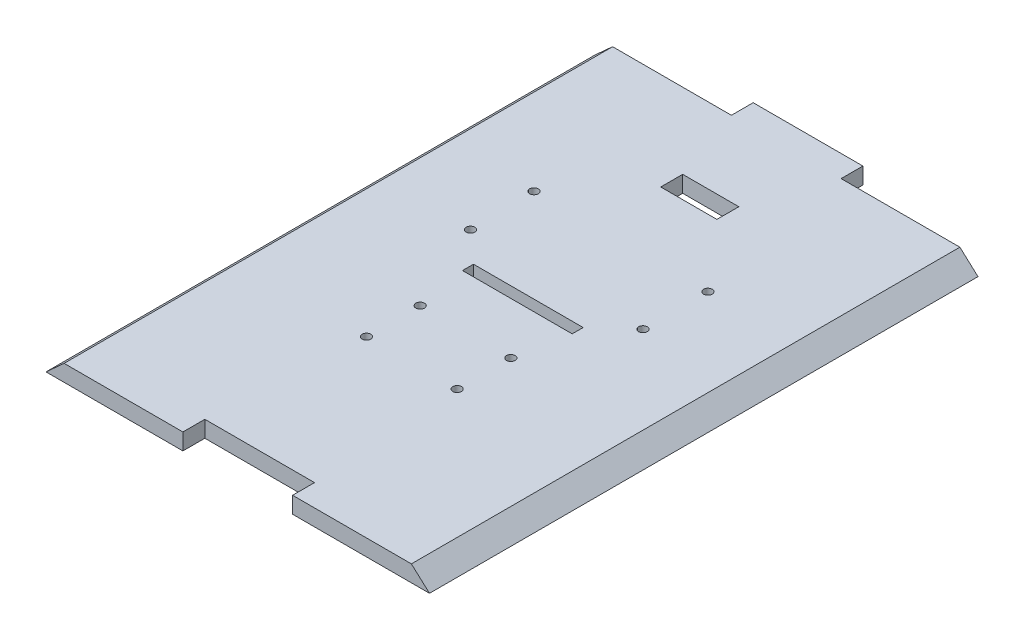
from build123d import *

# Parameters (mm, degrees)
BOSS_EXTRUDE1_DEPTH = 127
SKETCH3_W           = 25.4
SKETCH3_H           = 5.08
CUT_EXTRUDE1_DEPTH  = 135.591199998
SKETCH4_W           = 25.4
SKETCH4_H           = 5.08
BOSS_EXTRUDE3_DEPTH = 3.81
SKETCH5_R           = 1
SKETCH5_R_2         = 0.999998
SKETCH5_W           = 13
SKETCH5_H           = 5.08
SKETCH5_W_2         = 25.4
SKETCH5_H_2         = 2.54
CUT_EXTRUDE2_DEPTH  = 135.591199998


with BuildPart() as part:
    # Sketch1 → Boss-Extrude1 (new body)
    with BuildSketch(Plane.XY):
        Polygon((-40.203883769, 5.937788296), (40.203883769, 5.937788296), (44.399042974, 2.127788296), (-44.399042974, 2.127788296), align=None)
    extrude(amount=BOSS_EXTRUDE1_DEPTH)

    # Sketch3 → Cut-Extrude1 (cut, through all)
    with BuildSketch(Plane.XZ.offset(-2.127788296)):
        with Locations((0, 124.46)):
            Rectangle(SKETCH3_W, SKETCH3_H)
    extrude(amount=-CUT_EXTRUDE1_DEPTH, mode=Mode.SUBTRACT)

    # Sketch4 → Boss-Extrude3 (add)
    with BuildSketch(Plane.XZ.offset(-2.127788296)):
        with Locations((0, -2.504739817)):
            Rectangle(SKETCH4_W, SKETCH4_H)
    extrude(amount=-BOSS_EXTRUDE3_DEPTH)

    # Sketch5 → Cut-Extrude2 (cut, through all)
    with BuildSketch(Plane(origin=(0, 2.127788296, 0), x_dir=(-1, 0, 0), z_dir=(0, -1, 0))):
        with Locations(Location((-19.96, -38.1, 0), (0, 0, 90))):
            Circle(SKETCH5_R)
        with Locations(Location((20.313021022, -38.1, 0), (0, 0, 90))):
            Circle(SKETCH5_R)
        with Locations(Location((19.96, -53.142840099, 0), (0, 0, 90))):
            Circle(SKETCH5_R)
        with Locations(Location((-19.96, -53.142840099, 0), (0, 0, 90))):
            Circle(SKETCH5_R)
        with Locations(Location((-10.44215584, -74.203260183, 0), (0, 0, 90))):
            Circle(SKETCH5_R)
        with Locations(Location((-10.44215584, -86.649260183, 0), (0, 0, 90))):
            Circle(SKETCH5_R)
        with Locations(Location((10.55784416, -74.203260183, 0), (0, 0, 90))):
            Circle(SKETCH5_R)
        with Locations(Location((10.55784416, -86.649260183, 0), (0, 0, 90))):
            Circle(SKETCH5_R)
        with Locations((-93.931058926, -72.649749874)):
            Circle(SKETCH5_R_2)
        with Locations((-93.931058926, -85.149749874)):
            Circle(SKETCH5_R)
        with Locations((-72.931058926, -72.649749874)):
            Circle(SKETCH5_R)
        with Locations((-72.931058926, -85.149749874)):
            Circle(SKETCH5_R)
        with Locations((-93.904836904, 5.641456719)):
            Circle(SKETCH5_R)
        with Locations((-53.184836904, 5.641456719)):
            Circle(SKETCH5_R)
        with Locations((-53.184836904, -9.358543281)):
            Circle(SKETCH5_R)
        with Locations((-93.904836904, -9.358543281)):
            Circle(SKETCH5_R)
        with Locations((0, -20.02)):
            Rectangle(SKETCH5_W, SKETCH5_H)
        with Locations((0, -60.995260183)):
            Rectangle(SKETCH5_W_2, SKETCH5_H_2)
    extrude(amount=-CUT_EXTRUDE2_DEPTH, mode=Mode.SUBTRACT)


solid = part.part
